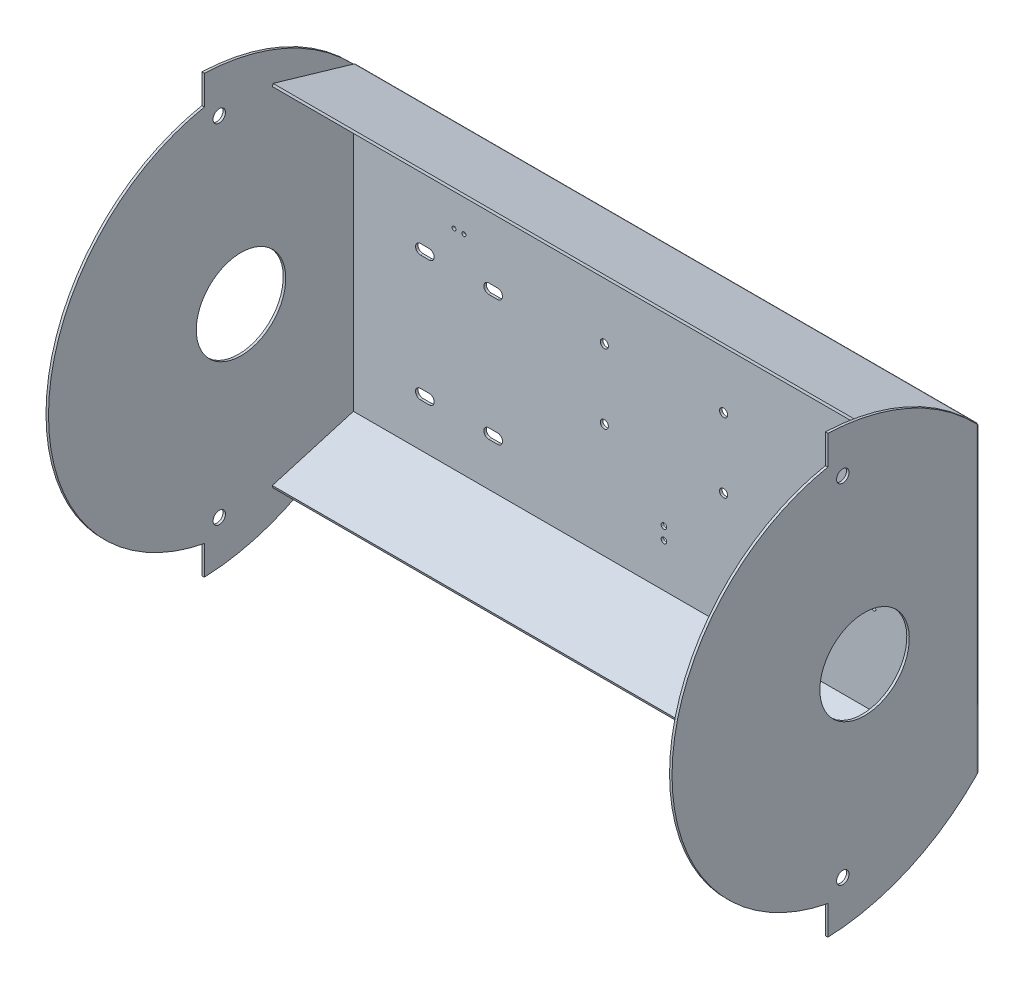
from build123d import *

# Parameters (mm, degrees)
ESQUISSE1_W                     = 500
ESQUISSE1_H                     = 240
EXTRUSION1_DEPTH                = 2
ESQUISSE2_R                     = 36
EXTRUSION2_DEPTH                = 2
ESQUISSE3_R                     = 5
ENL_V_MAT_EXTRU_1_DEPTH         = 2
EXTRUSION3_DEPTH                = 500
CONG_1_R                        = 2
ESQUISSE5_R                     = 3.25
ENL_V_MAT_EXTRU_2_DEPTH         = 2
ENL_V_MAT_EXTRU_3_DEPTH         = 2
R_P_TITION_LIN_AIRE1_COUNT      = 2
R_P_TITION_LIN_AIRE1_PITCH      = 101
R_P_TITION_LIN_AIRE1_COUNT_DIR2 = 2
R_P_TITION_LIN_AIRE1_PITCH_DIR2 = 55
ENL_V_MAT_EXTRU_4_DEPTH         = 2
R_P_TITION_LIN_AIRE2_COUNT      = 2
R_P_TITION_LIN_AIRE2_PITCH      = 55
R_P_TITION_LIN_AIRE2_COUNT_DIR2 = 2
R_P_TITION_LIN_AIRE2_PITCH_DIR2 = 101
ESQUISSE8_R                     = 2.75
ENL_V_MAT_EXTRU_5_DEPTH         = 2
ESQUISSE9_R                     = 2.75
ENL_V_MAT_EXTRU_6_DEPTH         = 2
ESQUISSE10_R                    = 1.6
ENL_V_MAT_EXTRU_7_DEPTH         = 394.248331319
ESQUISSE11_R                    = 2.25
ENL_V_MAT_EXTRU_8_DEPTH         = 10


with BuildPart() as part:
    # Esquisse1 → Extrusion1 (new body)
    with BuildSketch(Plane.XY):
        Rectangle(ESQUISSE1_W, ESQUISSE1_H)
    extrude(amount=EXTRUSION1_DEPTH)

    # Esquisse2 → Extrusion2 (add)
    with BuildSketch(Plane.ZY.offset(250)):
        with BuildLine():
            Line((122, -152.166849215), (122, -175.698605572))
            ThreePointArc((122, -175.698605572), (55.48059391, -159.938789336), (0, -120))
            Line((0, -120), (0, 120))
            ThreePointArc((0, 120), (55.48059391, 159.938789336), (122, 175.698605572))
            Line((122, 175.698605572), (122, 152.166849215))
            ThreePointArc((122, 152.166849215), (247.5, 0), (122, -152.166849215))
        make_face()
        with Locations(Location((92.5, 0, 0), (0, 0, 270))):
            Circle(ESQUISSE2_R, mode=Mode.SUBTRACT)
    extrusion2 = extrude(amount=EXTRUSION2_DEPTH)

    # Esquisse3 → Enlèv. mat.-Extru.1 (cut)
    with BuildSketch(Plane.ZY.offset(252)):
        with Locations(Location((110, 140, 0), (0, 0, 270))):
            Circle(ESQUISSE3_R)
        with Locations(Location((110, -140, 0), (0, 0, 90))):
            Circle(ESQUISSE3_R)
    enl_v_mat_extru_1 = extrude(amount=-ENL_V_MAT_EXTRU_1_DEPTH, mode=Mode.SUBTRACT)

    # Symétrie1: Extrusion2, Enlèv. mat.-Extru.1 across plane
    add(extrusion2.mirror(Plane(origin=(0, 0, 0), x_dir=(0, 0, 1), z_dir=(1, 0, 0))))
    add(enl_v_mat_extru_1.mirror(Plane(origin=(0, 0, 0), x_dir=(0, 0, 1), z_dir=(1, 0, 0))), mode=Mode.SUBTRACT)

    # Esquisse4 → Extrusion3 (add)
    with BuildSketch(Plane(origin=(-250, 0, 0), x_dir=(0, 0, -1), z_dir=(1, 0, 0))):
        Polygon((-2, -120), (-67.268218737, -139.080346508), (-66.707032075, -141), (0, -121.499034429), (0, -120), align=None)
    extrusion3 = extrude(amount=EXTRUSION3_DEPTH)

    # Symétrie2: Extrusion3 across plane
    add(extrusion3.mirror(Plane.ZX))

    # Congé1
    cong_1_edges = [part.edges().sort_by_distance(p)[0] for p in [
        (-252, 0, 0),
        (252, 0, 0),
        (0, -121.499034429, 0),
        (0, 121.499034429, 0),
    ]]
    fillet(cong_1_edges, radius=CONG_1_R)

    # Esquisse5 → Enlèv. mat.-Extru.2 (cut)
    with BuildSketch(Plane.XY.offset(2)):
        with Locations((-48, 28)):
            Circle(ESQUISSE5_R)
        with Locations(Location((48, 28, 0), (0, 0, 180))):
            Circle(ESQUISSE5_R)
        with Locations((48, -28)):
            Circle(ESQUISSE5_R)
        with Locations(Location((-48, -28, 0), (0, 0, 180))):
            Circle(ESQUISSE5_R)
    extrude(amount=-ENL_V_MAT_EXTRU_2_DEPTH, mode=Mode.SUBTRACT)

    # Esquisse6 → Enlèv. mat.-Extru.3 (cut)
    with BuildSketch(Plane.XY.offset(2)):
        with BuildLine():
            Line((189, 85), (196, 85))
            ThreePointArc((196, 85), (200, 81), (196, 77))
            Line((196, 77), (189, 77))
            ThreePointArc((189, 77), (185, 81), (189, 85))
        make_face()
    enl_v_mat_extru_3 = extrude(amount=-ENL_V_MAT_EXTRU_3_DEPTH, mode=Mode.SUBTRACT)

    # Répétition linéaire1: Enl_v. mat.-Extru.3 2 × 2
    with Locations(*[(-j * R_P_TITION_LIN_AIRE1_PITCH_DIR2, -i * R_P_TITION_LIN_AIRE1_PITCH, 0) for i in range(R_P_TITION_LIN_AIRE1_COUNT) for j in range(R_P_TITION_LIN_AIRE1_COUNT_DIR2) if (i, j) != (0, 0)]):
        add(enl_v_mat_extru_3, mode=Mode.SUBTRACT)

    # Esquisse7 → Enlèv. mat.-Extru.4 (cut)
    with BuildSketch(Plane.XY.offset(2)):
        with BuildLine():
            Line((-196, -77), (-189, -77))
            ThreePointArc((-189, -77), (-185, -81), (-189, -85))
            Line((-189, -85), (-196, -85))
            ThreePointArc((-196, -85), (-200, -81), (-196, -77))
        make_face()
    enl_v_mat_extru_4 = extrude(amount=-ENL_V_MAT_EXTRU_4_DEPTH, mode=Mode.SUBTRACT)

    # Répétition linéaire2: Enl_v. mat.-Extru.4 2 × 2
    with Locations(*[(i * R_P_TITION_LIN_AIRE2_PITCH, j * R_P_TITION_LIN_AIRE2_PITCH_DIR2, 0) for i in range(R_P_TITION_LIN_AIRE2_COUNT) for j in range(R_P_TITION_LIN_AIRE2_COUNT_DIR2) if (i, j) != (0, 0)]):
        add(enl_v_mat_extru_4, mode=Mode.SUBTRACT)

    # Esquisse8 → Enlèv. mat.-Extru.5 (cut)
    with BuildSketch(Plane.XY.offset(2)):
        with Locations((-241, 87.5)):
            Circle(ESQUISSE8_R)
        with Locations((-71, 87.5)):
            Circle(ESQUISSE8_R)
    extrude(amount=-ENL_V_MAT_EXTRU_5_DEPTH, mode=Mode.SUBTRACT)

    # Esquisse9 → Enlèv. mat.-Extru.6 (cut)
    with BuildSketch(Plane.XY.offset(2)):
        with Locations((71, -87.5)):
            Circle(ESQUISSE9_R)
        with Locations((241, -87.5)):
            Circle(ESQUISSE9_R)
    extrude(amount=-ENL_V_MAT_EXTRU_6_DEPTH, mode=Mode.SUBTRACT)

    # Esquisse10 → Enlèv. mat.-Extru.7 (cut, through all)
    with BuildSketch(Plane.XY.offset(2)):
        with Locations((-169, 48)):
            Circle(ESQUISSE10_R)
        with Locations((-161, 48)):
            Circle(ESQUISSE10_R)
        with Locations((161, -48)):
            Circle(ESQUISSE10_R)
        with Locations((169, -48)):
            Circle(ESQUISSE10_R)
    extrude(amount=-ENL_V_MAT_EXTRU_7_DEPTH, mode=Mode.SUBTRACT)

    # Esquisse11 → Enlèv. mat.-Extru.8 (cut)
    with BuildSketch(Plane.XY.offset(2)):
        with Locations((0, -75)):
            Circle(ESQUISSE11_R)
        with Locations((0, -85)):
            Circle(ESQUISSE11_R)
    extrude(amount=-ENL_V_MAT_EXTRU_8_DEPTH, mode=Mode.SUBTRACT)


solid = part.part
